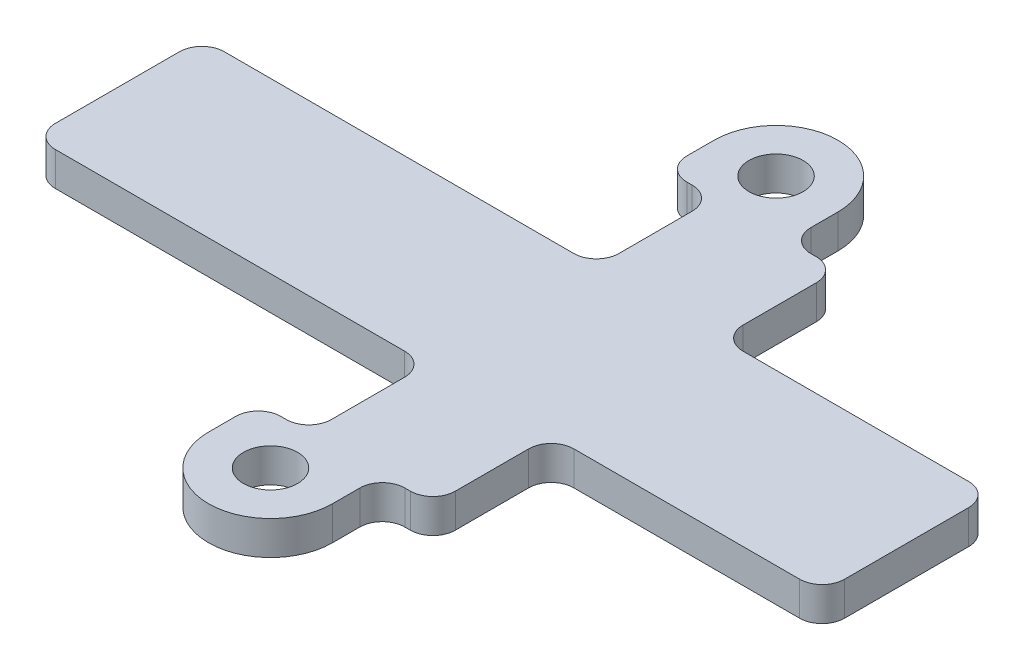
from build123d import *

# Parameters (mm, degrees)
SKETCH1_W            = 13.25
SKETCH1_H            = 7.5
SKETCH1_W_2          = 2
SKETCH1_W_3          = 2.24
SKETCH1_W_4          = 3.26
SKETCH1_W_5          = 8.01
SKETCH1_H_2          = 3.25
SKETCH1_H_3          = 2
SKETCH1_R            = 1.25
BOSS_EXTRUDE1_DEPTH  = 1.5
M2_CLEARANCE_HOLE1_D = 2.4
FILLET1_R            = 1


with BuildPart() as part:
    # Sketch1 → Boss-Extrude1 (new body)
    # profile 1 of 22: a face of its own
    with BuildSketch(Plane(origin=(0, 0, 0), x_dir=(1, 0, 0), z_dir=(0, 1, 0))):
        with Locations((-9.375, 0)):
            Rectangle(SKETCH1_W, SKETCH1_H)
    # profile 2 of 22: a face of its own
    with BuildSketch(Plane(origin=(0, 0, 0), x_dir=(1, 0, 0), z_dir=(0, 1, 0))):
        with Locations((-17, 0)):
            Rectangle(SKETCH1_W_2, SKETCH1_H)
    # profile 3 of 22: a face of its own
    with BuildSketch(Plane(origin=(0, 0, 0), x_dir=(1, 0, 0), z_dir=(0, 1, 0))):
        with Locations((-1.63, 0)):
            Rectangle(SKETCH1_W_3, SKETCH1_H)
    # profile 4 of 22: a face of its own
    with BuildSketch(Plane(origin=(0, 0, 0), x_dir=(1, 0, 0), z_dir=(0, 1, 0))):
        with Locations((1.12, 0)):
            Rectangle(SKETCH1_W_4, SKETCH1_H)
    # profile 5 of 22: a face of its own
    with BuildSketch(Plane(origin=(0, 0, 0), x_dir=(1, 0, 0), z_dir=(0, 1, 0))):
        with Locations((3.87, 0)):
            Rectangle(SKETCH1_W_3, SKETCH1_H)
    # profile 6 of 22: a face of its own
    with BuildSketch(Plane(origin=(0, 0, 0), x_dir=(1, 0, 0), z_dir=(0, 1, 0))):
        with Locations((8.995, 0)):
            Rectangle(SKETCH1_W_5, SKETCH1_H)
    # profile 7 of 22: a face of its own
    with BuildSketch(Plane(origin=(0, 0, 0), x_dir=(1, 0, 0), z_dir=(0, 1, 0))):
        with Locations((14, 0)):
            Rectangle(SKETCH1_W_2, SKETCH1_H)
    # profile 8 of 22: a face of its own
    with BuildSketch(Plane(origin=(0, 0, 0), x_dir=(1, 0, 0), z_dir=(0, 1, 0))):
        with Locations((16, 0)):
            Rectangle(SKETCH1_W_2, SKETCH1_H)
    # profile 9 of 22: a face of its own
    with BuildSketch(Plane(origin=(0, 0, 0), x_dir=(1, 0, 0), z_dir=(0, 1, 0))):
        with Locations((3.87, 5.375)):
            Rectangle(SKETCH1_W_3, SKETCH1_H_2)
    # profile 10 of 22: a face of its own
    with BuildSketch(Plane(origin=(0, 0, 0), x_dir=(1, 0, 0), z_dir=(0, 1, 0))):
        with Locations((3.87, -5.375)):
            Rectangle(SKETCH1_W_3, SKETCH1_H_2)
    # profile 11 of 22: a face of its own
    with BuildSketch(Plane(origin=(0, 0, 0), x_dir=(1, 0, 0), z_dir=(0, 1, 0))):
        with Locations((3.87, -8)):
            Rectangle(SKETCH1_W_3, SKETCH1_H_3)
    # profile 12 of 22: a face of its own
    with BuildSketch(Plane(origin=(0, 0, 0), x_dir=(1, 0, 0), z_dir=(0, 1, 0))):
        with Locations((1.12, -8)):
            Rectangle(SKETCH1_W_4, SKETCH1_H_3)
    # profile 13 of 22: a face of its own
    with BuildSketch(Plane(origin=(0, 0, 0), x_dir=(1, 0, 0), z_dir=(0, 1, 0))):
        with Locations((1.12, -5.375)):
            Rectangle(SKETCH1_W_4, SKETCH1_H_2)
    # profile 14 of 22: a face of its own
    with BuildSketch(Plane(origin=(0, 0, 0), x_dir=(1, 0, 0), z_dir=(0, 1, 0))):
        with Locations((1.12, 5.375)):
            Rectangle(SKETCH1_W_4, SKETCH1_H_2)
    # profile 15 of 22: a face of its own
    with BuildSketch(Plane(origin=(0, 0, 0), x_dir=(1, 0, 0), z_dir=(0, 1, 0))):
        with Locations((1.12, 8)):
            Rectangle(SKETCH1_W_4, SKETCH1_H_3)
    # profile 16 of 22: a face of its own
    with BuildSketch(Plane(origin=(0, 0, 0), x_dir=(1, 0, 0), z_dir=(0, 1, 0))):
        with Locations((3.87, 8)):
            Rectangle(SKETCH1_W_3, SKETCH1_H_3)
    # profile 17 of 22: a face of its own
    with BuildSketch(Plane(origin=(0, 0, 0), x_dir=(1, 0, 0), z_dir=(0, 1, 0))):
        with BuildLine():
            Line((2.75, 9.125), (2.75, 11.2072))
            ThreePointArc((2.75, 11.2072), (0, 13.9572), (-2.75, 11.2072))
            Line((-2.75, 11.2072), (-2.75, 9.125))
            Line((-2.75, 9.125), (2.75, 9.125))
        make_face()
        with Locations((0, 11.2072)):
            Circle(SKETCH1_R, mode=Mode.SUBTRACT)
    # profile 18 of 22: a face of its own
    with BuildSketch(Plane(origin=(0, 0, 0), x_dir=(1, 0, 0), z_dir=(0, 1, 0))):
        with BuildLine():
            Line((2.75, -11.2072), (2.75, -9.125))
            Line((2.75, -9.125), (-2.75, -9.125))
            Line((-2.75, -9.125), (-2.75, -11.2072))
            ThreePointArc((-2.75, -11.2072), (0, -13.9572), (2.75, -11.2072))
        make_face()
        with Locations((0, -11.2072)):
            Circle(SKETCH1_R, mode=Mode.SUBTRACT)
    # profile 19 of 22: a face of its own
    with BuildSketch(Plane(origin=(0, 0, 0), x_dir=(1, 0, 0), z_dir=(0, 1, 0))):
        Polygon((2.75, 9), (2.75, 9.125), (-2.75, 9.125), (-2.75, 9), (-0.51, 9), align=None)
    # profile 20 of 22: a face of its own
    with BuildSketch(Plane(origin=(0, 0, 0), x_dir=(1, 0, 0), z_dir=(0, 1, 0))):
        with Locations((0, 11.2072)):
            Circle(SKETCH1_R)
    # profile 21 of 22: a face of its own
    with BuildSketch(Plane(origin=(0, 0, 0), x_dir=(1, 0, 0), z_dir=(0, 1, 0))):
        with Locations((0, -11.2072)):
            Circle(SKETCH1_R)
    # profile 22 of 22: a face of its own
    with BuildSketch(Plane(origin=(0, 0, 0), x_dir=(1, 0, 0), z_dir=(0, 1, 0))):
        Polygon((2.75, -9.125), (2.75, -9), (-0.51, -9), (-2.75, -9), (-2.75, -9.125), align=None)
    extrude(amount=BOSS_EXTRUDE1_DEPTH)

    # M2 Clearance Hole1 (through all)
    with Locations(Plane(origin=(0, 0, -11.2072), x_dir=(0, 0, -1), z_dir=(0, -1, 0))):
        with Locations((0, 0), (-22.4144, 0)):
            Hole(M2_CLEARANCE_HOLE1_D / 2)

    # Fillet1
    fillet1_edges = [part.edges().sort_by_distance(p)[0] for p in [
        (-0.51, 0.75, 3.75),
        (-18, 0.75, 3.75),
        (-18, 0.75, -3.75),
        (-0.51, 0.75, -3.75),
        (-0.51, 0.75, -9),
        (-2.75, 0.75, -9),
        (2.75, 0.75, -9),
        (4.99, 0.75, -9),
        (4.99, 0.75, -3.75),
        (17, 0.75, -3.75),
        (17, 0.75, 3.75),
        (4.99, 0.75, 3.75),
        (4.99, 0.75, 9),
        (2.75, 0.75, 9),
        (-2.75, 0.75, 9),
        (-0.51, 0.75, 9),
    ]]
    fillet(fillet1_edges, radius=FILLET1_R)


solid = part.part
